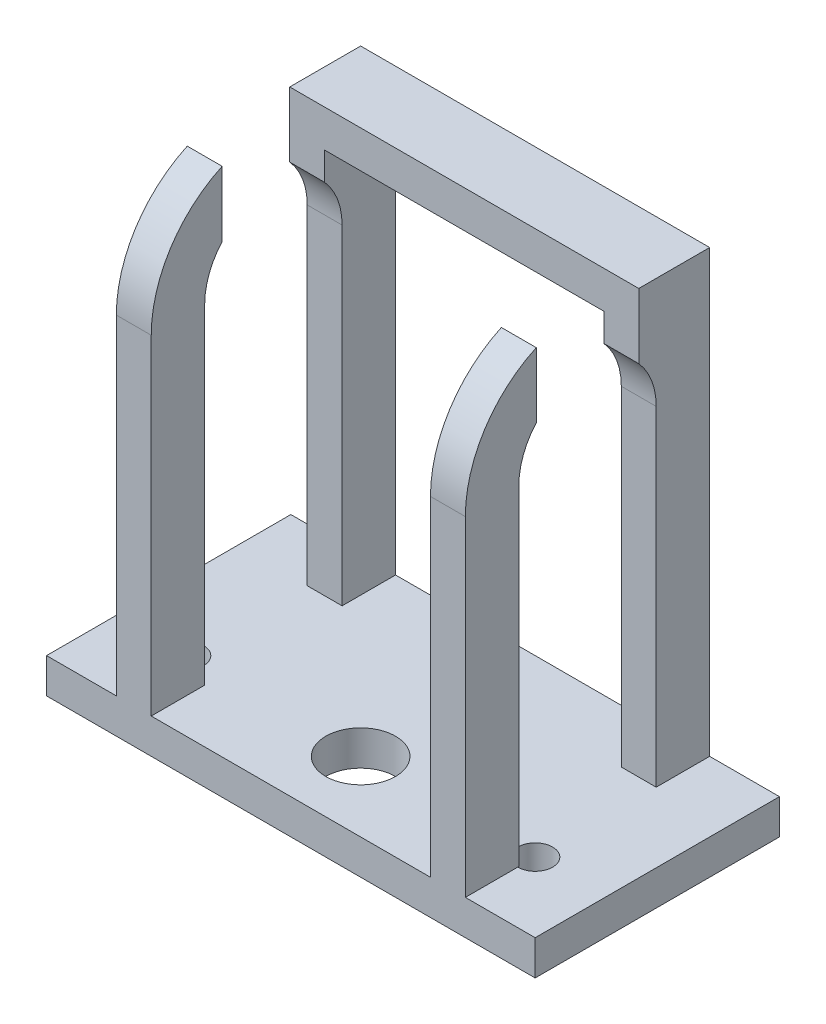
from build123d import *

# Parameters (mm, degrees)
SKETCH2_W           = 88.9
SKETCH2_H           = 44.45
SKETCH2_R           = 6.35
SKETCH2_R_2         = 3.175
BOSS_EXTRUDE1_DEPTH = 6.35
SKETCH3_R           = 22.225
SKETCH3_W           = 44.45
SKETCH3_H           = 60
BOSS_EXTRUDE2_DEPTH = 6.35
CUT_EXTRUDE1_REACH  = 123.079
SKETCH4_R           = 12.5
SKETCH4_W           = 25
SKETCH4_H           = 60
SKETCH4_W_2         = 18.65
SKETCH4_H_2         = 13.900675703
SKETCH5_W           = 9.725
SKETCH5_H           = 8.324324297
BOSS_EXTRUDE3_DEPTH = 6.35
SKETCH6_W           = 12.9
SKETCH6_H           = 6.769792784
BOSS_EXTRUDE4_DEPTH = 57.15


with BuildPart() as part:
    # Sketch2 → Boss-Extrude1 (new body)
    with BuildSketch(Plane(origin=(0, 0, 0), x_dir=(1, 0, 0), z_dir=(0, 1, 0))):
        with Locations((0, 9.525)):
            Rectangle(SKETCH2_W, SKETCH2_H)
        with Locations(Location((0, 0, 0), (0, 0, 270))):
            Circle(SKETCH2_R, mode=Mode.SUBTRACT)
        with Locations(Location((-31.75, 0, 0), (0, 0, 270))):
            Circle(SKETCH2_R_2, mode=Mode.SUBTRACT)
        with Locations(Location((31.75, 0, 0), (0, 0, 90))):
            Circle(SKETCH2_R_2, mode=Mode.SUBTRACT)
    extrude(amount=BOSS_EXTRUDE1_DEPTH)

    # Sketch3 → Boss-Extrude2 (add)
    with BuildSketch(Plane(origin=(25.4, 0, 0), x_dir=(0, 0, -1), z_dir=(1, 0, 0))):
        with Locations((9.525, 66.35)):
            Circle(SKETCH3_R)
        with Locations((9.525, 36.35)):
            Rectangle(SKETCH3_W, SKETCH3_H)
    boss_extrude2 = extrude(amount=BOSS_EXTRUDE2_DEPTH)

    # Cut-Extrude1: up to this face of the body (flat: up to its plane)
    cut_extrude1_end = Plane(part.part.faces().sort_by_distance((25.4, 45.236582144, -9.525))[0])
    # Sketch4 → Cut-Extrude1 (cut, up to the picked face)
    with BuildSketch(Plane(origin=(31.75, 0, 0), x_dir=(0, 0, -1), z_dir=(1, 0, 0)), mode=Mode.PRIVATE) as cut_extrude1_sk1:
        with Locations((9.525, 66.35)):
            Circle(SKETCH4_R)
    cut_extrude1_tool1 = split(extrude(cut_extrude1_sk1.sketch, amount=-CUT_EXTRUDE1_REACH, mode=Mode.PRIVATE), bisect_by=cut_extrude1_end, keep=Keep.BOTH, mode=Mode.PRIVATE)
    # Sketch4 → Cut-Extrude1 (cut, up to the picked face)
    with BuildSketch(Plane(origin=(31.75, 0, 0), x_dir=(0, 0, -1), z_dir=(1, 0, 0)), mode=Mode.PRIVATE) as cut_extrude1_sk2:
        with Locations((9.525, 36.35)):
            Rectangle(SKETCH4_W, SKETCH4_H)
    cut_extrude1_tool2 = split(extrude(cut_extrude1_sk2.sketch, amount=-CUT_EXTRUDE1_REACH, mode=Mode.PRIVATE), bisect_by=cut_extrude1_end, keep=Keep.BOTH, mode=Mode.PRIVATE)
    # Sketch4 → Cut-Extrude1 (cut, up to the picked face)
    with BuildSketch(Plane(origin=(31.75, 0, 0), x_dir=(0, 0, -1), z_dir=(1, 0, 0)), mode=Mode.PRIVATE) as cut_extrude1_sk3:
        with Locations((9.525, 81.624662148)):
            Rectangle(SKETCH4_W_2, SKETCH4_H_2)
    cut_extrude1_tool3 = split(extrude(cut_extrude1_sk3.sketch, amount=-CUT_EXTRUDE1_REACH, mode=Mode.PRIVATE), bisect_by=cut_extrude1_end, keep=Keep.BOTH, mode=Mode.PRIVATE)
    cut_extrude1_1 = cut_extrude1_tool1.solids().sort_by(Axis((31.75, 66.35, -9.525), (-1, 0, 0)))[0]
    add(cut_extrude1_1, mode=Mode.SUBTRACT)
    cut_extrude1_2 = cut_extrude1_tool2.solids().sort_by(Axis((31.75, 36.35, -9.525), (-1, 0, 0)))[0]
    add(cut_extrude1_2, mode=Mode.SUBTRACT)
    cut_extrude1_3 = cut_extrude1_tool3.solids().sort_by(Axis((31.75, 81.624662, -9.525), (-1, 0, 0)))[0]
    add(cut_extrude1_3, mode=Mode.SUBTRACT)
    cut_extrude1 = cut_extrude1_1 + cut_extrude1_2 + cut_extrude1_3  # Cut-Extrude1 as one shape, for the pattern or mirror that repeats it

    # Sketch5 → Boss-Extrude3 (add)
    with BuildSketch(Plane(origin=(31.75, 0, 0), x_dir=(0, 0, -1), z_dir=(1, 0, 0))):
        Polygon((31.75, 86.524117081), (18.85, 86.524117081), (18.85, 74.674324297), (22.025, 74.674324297), (31.75, 74.674324297), align=None)
        with Locations((26.8875, 70.512162149)):
            Rectangle(SKETCH5_W, SKETCH5_H)
    boss_extrude3 = extrude(amount=-BOSS_EXTRUDE3_DEPTH)

    # Mirror1: Boss-Extrude2, Cut-Extrude1, Boss-Extrude3 across plane
    add(boss_extrude2.mirror(Plane(origin=(0, 0, 0), x_dir=(0, 0, 1), z_dir=(1, 0, 0))))
    add(cut_extrude1.mirror(Plane(origin=(0, 0, 0), x_dir=(0, 0, 1), z_dir=(1, 0, 0))), mode=Mode.SUBTRACT)
    add(boss_extrude3.mirror(Plane(origin=(0, 0, 0), x_dir=(0, 0, 1), z_dir=(1, 0, 0))))

    # Sketch6 → Boss-Extrude4 (add)
    with BuildSketch(Plane(origin=(31.75, 0, 0), x_dir=(0, 0, -1), z_dir=(1, 0, 0))):
        with Locations((25.3, 83.139220689)):
            Rectangle(SKETCH6_W, SKETCH6_H)
    extrude(amount=-BOSS_EXTRUDE4_DEPTH)


solid = part.part
